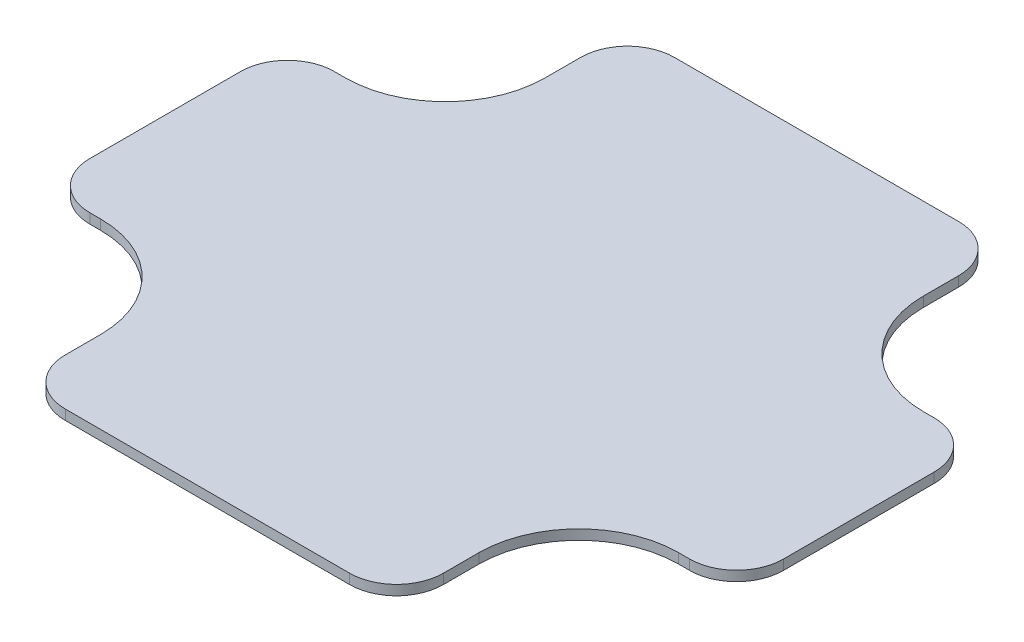
from build123d import *

# Parameters (mm, degrees)
BOSS_EXTRUDE1_DEPTH = 3.175


with BuildPart() as part:
    # Sketch1 → Boss-Extrude1 (new body)
    with BuildSketch(Plane(origin=(0, 0, 0), x_dir=(1, 0, 0), z_dir=(0, 1, 0))):
        with BuildLine():
            Line((-96, 39.13235), (-92.5, 39.13235))
            ThreePointArc((-92.5, 39.13235), (-69.872583002, 48.504933002), (-60.5, 71.13235))
            Line((-60.5, 71.13235), (-60.5, 82.46855))
            ThreePointArc((-60.5, 82.46855), (-56.106601718, 93.075151718), (-45.5, 97.46855))
            Line((-45.5, 97.46855), (45.5, 97.46855))
            ThreePointArc((45.5, 97.46855), (56.106601718, 93.075151718), (60.5, 82.46855))
            Line((60.5, 82.46855), (60.5, 71.13235))
            ThreePointArc((60.5, 71.13235), (69.872583002, 48.504933002), (92.5, 39.13235))
            Line((92.5, 39.13235), (96, 39.13235))
            ThreePointArc((96, 39.13235), (106.606601718, 34.738951718), (111, 24.13235))
            Line((111, 24.13235), (111, -24.13235))
            ThreePointArc((111, -24.13235), (106.606601718, -34.738951718), (96, -39.13235))
            Line((96, -39.13235), (92.5, -39.13235))
            ThreePointArc((92.5, -39.13235), (69.872583002, -48.504933002), (60.5, -71.13235))
            Line((60.5, -71.13235), (60.5, -82.46855))
            ThreePointArc((60.5, -82.46855), (56.106601718, -93.075151718), (45.5, -97.46855))
            Line((45.5, -97.46855), (-45.5, -97.46855))
            ThreePointArc((-45.5, -97.46855), (-56.106601718, -93.075151718), (-60.5, -82.46855))
            Line((-60.5, -82.46855), (-60.5, -71.13235))
            ThreePointArc((-60.5, -71.13235), (-69.872583002, -48.504933002), (-92.5, -39.13235))
            Line((-92.5, -39.13235), (-96, -39.13235))
            ThreePointArc((-96, -39.13235), (-106.606601718, -34.738951718), (-111, -24.13235))
            Line((-111, -24.13235), (-111, 24.13235))
            ThreePointArc((-111, 24.13235), (-106.606601718, 34.738951718), (-96, 39.13235))
        make_face()
    extrude(amount=BOSS_EXTRUDE1_DEPTH)


solid = part.part
